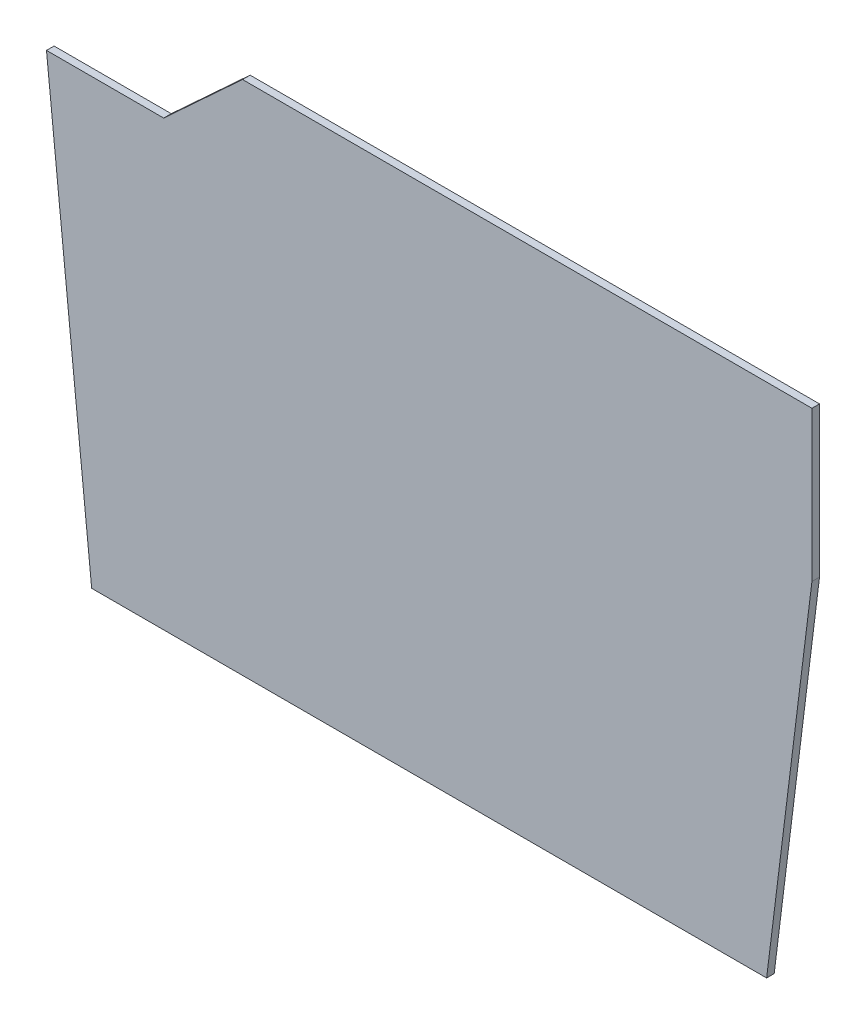
from build123d import *

# Parameters (mm, degrees)
BOSS_EXTRU_1_DEPTH = 5


with BuildPart() as part:
    # Esquisse1 → Boss.-Extru.1 (new body)
    with BuildSketch(Plane.XY):
        Polygon((0.107118927, -75), (29.903245329, -367.3), (474.959430721, -367.3), (504.843253, -125.938328726), (504.843253, -27), (129.390983834, -27), (77.390983834, -75), align=None)
    extrude(amount=BOSS_EXTRU_1_DEPTH)


solid = part.part
